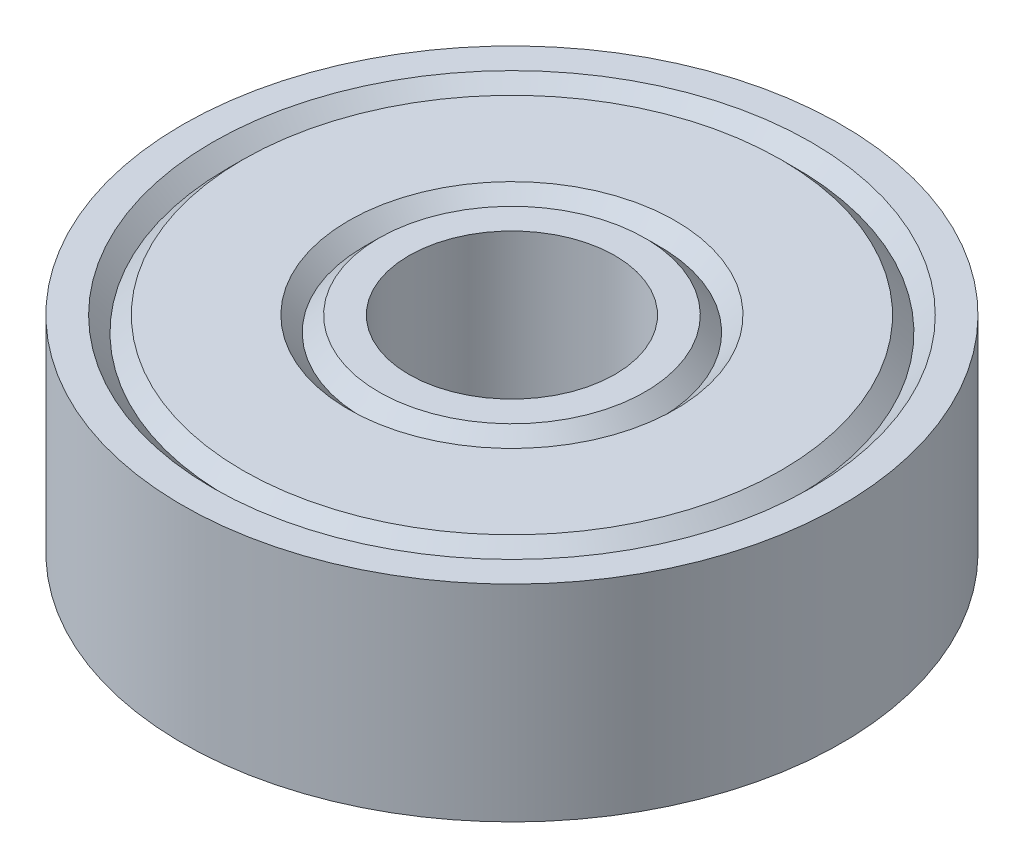
from build123d import *


with BuildPart() as part:
    # Sketch1 → Revolve1 (revolve)
    with BuildSketch(Plane.XY):
        Polygon((-2.5, 2.5), (-3.233333333, 2.5), (-3.6, 2.133333333), (-3.966666667, 2.5), (-6.533333333, 2.5), (-6.9, 2.133333333), (-7.266666667, 2.5), (-8, 2.5), (-8, -2.5), (-7.266666667, -2.5), (-6.9, -2.133333333), (-6.533333333, -2.5), (-3.966666667, -2.5), (-3.6, -2.133333333), (-3.233333333, -2.5), (-2.5, -2.5), align=None)
    revolve(axis=Axis((0, 2.5, 0), (0, -1, 0)))


solid = part.part
